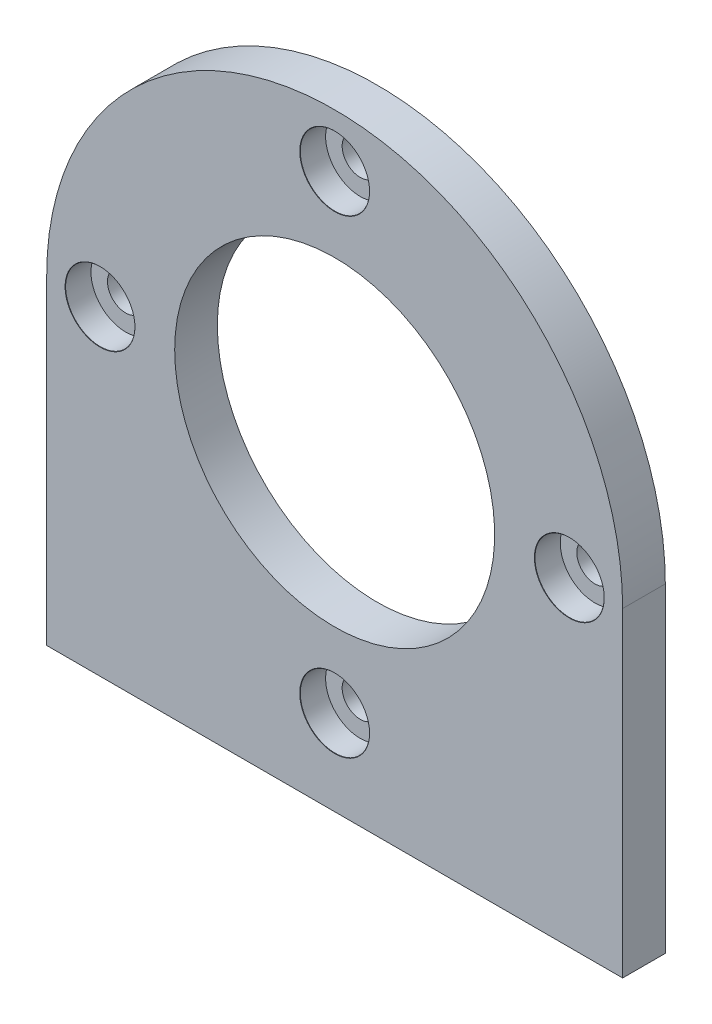
from build123d import *

# Parameters (mm, degrees)
SKETCH1_R                                    = 27
BOSS_EXTRUDE1_DEPTH                          = 4
CBORE_FOR_M3_HEX_SOCKET_THIN_HEAD_CA_2_COUNT = 2
CBORE_FOR_M3_HEX_SOCKET_THIN_HEAD_CA_2_PITCH = 31.112698372
CBORE_FOR_M3_HEX_SOCKET_THIN_HEAD_CA_3_COUNT = 2
CBORE_FOR_M3_HEX_SOCKET_THIN_HEAD_CA_3_PITCH = 44
CBORE_FOR_M3_HEX_SOCKET_THIN_HEAD_CA_4_COUNT = 2
CBORE_FOR_M3_HEX_SOCKET_THIN_HEAD_CA_4_PITCH = 31.112698372
BOSS_EXTRUDE2_START                          = -4
BOSS_EXTRUDE2_DEPTH                          = 4
SKETCH5_R                                    = 15
CUT_EXTRUDE1_DEPTH                           = 41.558599581


with BuildPart() as part:
    # Sketch1 → Boss-Extrude1 (new body)
    with BuildSketch(Plane.XY):
        Circle(SKETCH1_R)
    extrude(amount=BOSS_EXTRUDE1_DEPTH)

    # Sketch3 → CBORE for M3 Hex Socket Thin Head Cap Screw1 (revolve, cut)
    with BuildSketch(Plane(origin=(-22, 0, 4), x_dir=(0, -1, 0), z_dir=(1, 0, 0))):
        Polygon((0, 0), (0, 4), (1.7, 4), (1.7, 2.4), (3.25, 2.4), (3.25, 0.025), (3.275, 0), align=None)
    cbore_for_m3_hex_socket_thin_head_cap_sc = revolve(axis=Axis((-22, 0, 10.35), (0, 0, -1)), mode=Mode.SUBTRACT)

    # CBORE for M3 Hex Socket Thin Head Ca 2: CBORE for M3 Hex Socket Thin Head Cap Screw1 ×2
    with Locations(*[Vector(0.7071067811865277, 0.7071067811865674, 0) * (i * CBORE_FOR_M3_HEX_SOCKET_THIN_HEAD_CA_2_PITCH) for i in range(1, CBORE_FOR_M3_HEX_SOCKET_THIN_HEAD_CA_2_COUNT)]):
        add(cbore_for_m3_hex_socket_thin_head_cap_sc, mode=Mode.SUBTRACT)

    # CBORE for M3 Hex Socket Thin Head Ca 3: CBORE for M3 Hex Socket Thin Head Cap Screw1 ×2
    with Locations(*[(i * CBORE_FOR_M3_HEX_SOCKET_THIN_HEAD_CA_3_PITCH, 0, 0) for i in range(1, CBORE_FOR_M3_HEX_SOCKET_THIN_HEAD_CA_3_COUNT)]):
        add(cbore_for_m3_hex_socket_thin_head_cap_sc, mode=Mode.SUBTRACT)

    # CBORE for M3 Hex Socket Thin Head Ca 4: CBORE for M3 Hex Socket Thin Head Cap Screw1 ×2
    with Locations(*[Vector(0.7071067811865676, -0.7071067811865276, 0) * (i * CBORE_FOR_M3_HEX_SOCKET_THIN_HEAD_CA_4_PITCH) for i in range(1, CBORE_FOR_M3_HEX_SOCKET_THIN_HEAD_CA_4_COUNT)]):
        add(cbore_for_m3_hex_socket_thin_head_cap_sc, mode=Mode.SUBTRACT)

    # Sketch4 → Boss-Extrude2 (add)
    with BuildSketch(Plane.XY.offset(4).offset(BOSS_EXTRUDE2_START)):
        with BuildLine():
            Line((-27, 0), (-27, -30))
            Line((-27, -30), (27, -30))
            Line((27, -30), (27, 0))
            ThreePointArc((27, 0), (0, -27), (-27, 0))
        make_face()
    extrude(amount=BOSS_EXTRUDE2_DEPTH)

    # Sketch5 → Cut-Extrude1 (cut, through all)
    with BuildSketch(Plane(origin=(0, 0, 0), x_dir=(-1, 0, 0), z_dir=(0, 0, -1))):
        Circle(SKETCH5_R)
    extrude(amount=-CUT_EXTRUDE1_DEPTH, mode=Mode.SUBTRACT)


solid = part.part
